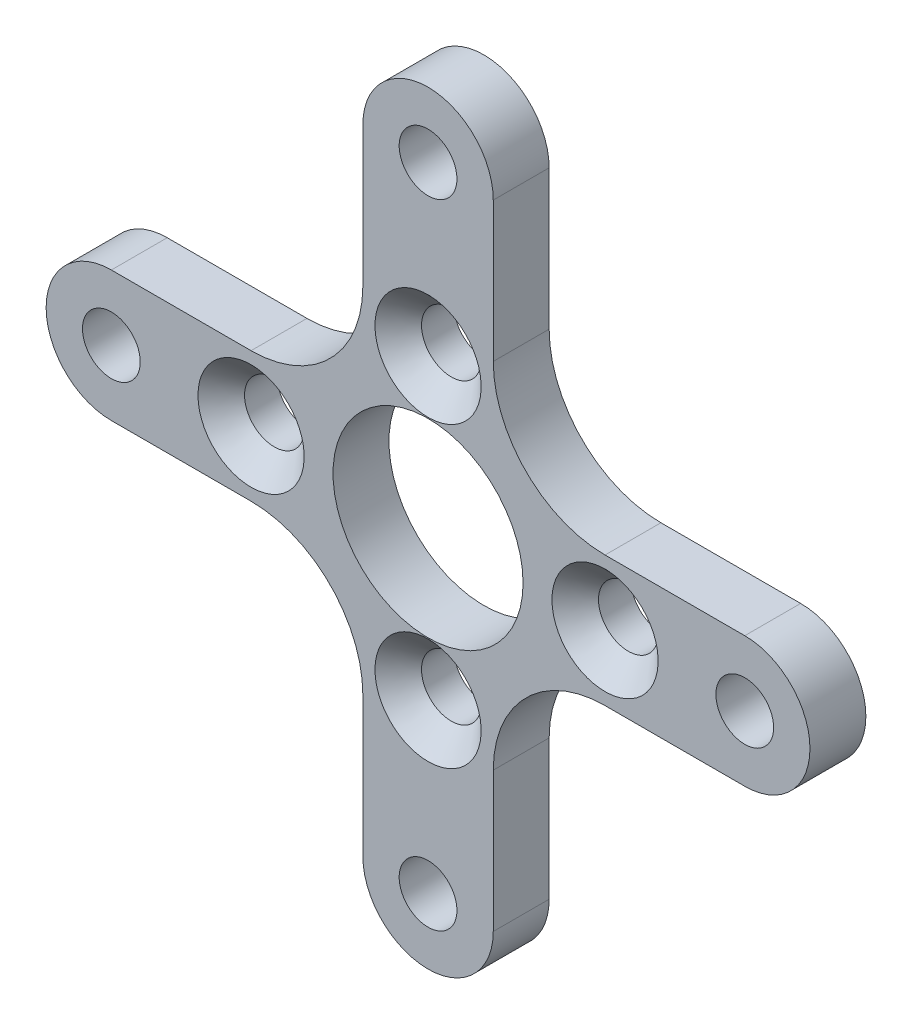
from build123d import *

# Parameters (mm, degrees)
SKETCH1_R           = 5.1
SKETCH1_R_2         = 1.6
SKETCH1_R_3         = 1.55
BOSS_EXTRUDE1_DEPTH = 3
CHAMFER1_SIZE       = 1.25


with BuildPart() as part:
    # Sketch1 → Boss-Extrude1 (new body)
    with BuildSketch(Plane(origin=(0, 0, 0), x_dir=(0, 1, 0), z_dir=(0, 0, 1))):
        with BuildLine():
            Line((3.5, 17), (3.5, 9.5))
            ThreePointArc((3.5, 9.5), (5.257359313, 5.257359313), (9.5, 3.5))
            Line((9.5, 3.5), (17, 3.5))
            ThreePointArc((17, 3.5), (20.5, 0), (17, -3.5))
            Line((17, -3.5), (9.5, -3.5))
            ThreePointArc((9.5, -3.5), (5.257359313, -5.257359313), (3.5, -9.5))
            Line((3.5, -9.5), (3.5, -17))
            ThreePointArc((3.5, -17), (0, -20.5), (-3.5, -17))
            Line((-3.5, -17), (-3.5, -9.5))
            ThreePointArc((-3.5, -9.5), (-5.257359313, -5.257359313), (-9.5, -3.5))
            Line((-9.5, -3.5), (-17, -3.5))
            ThreePointArc((-17, -3.5), (-20.5, 0), (-17, 3.5))
            Line((-17, 3.5), (-9.5, 3.5))
            ThreePointArc((-9.5, 3.5), (-5.257359313, 5.257359313), (-3.5, 9.5))
            Line((-3.5, 9.5), (-3.5, 17))
            ThreePointArc((-3.5, 17), (0, 20.5), (3.5, 17))
        make_face()
        with Locations(Location((0, 0, 0), (0, 0, 270))):
            Circle(SKETCH1_R, mode=Mode.SUBTRACT)
        with Locations(Location((0, 9.5, 0), (0, 0, 270))):
            Circle(SKETCH1_R_2, mode=Mode.SUBTRACT)
        with Locations(Location((8, 0, 0), (0, 0, 270))):
            Circle(SKETCH1_R_2, mode=Mode.SUBTRACT)
        with Locations(Location((-8, 0, 0), (0, 0, 270))):
            Circle(SKETCH1_R_2, mode=Mode.SUBTRACT)
        with Locations(Location((0, -9.5, 0), (0, 0, 270))):
            Circle(SKETCH1_R_2, mode=Mode.SUBTRACT)
        with Locations(Location((0, 17, 0), (0, 0, 270))):
            Circle(SKETCH1_R_3, mode=Mode.SUBTRACT)
        with Locations(Location((17, 0, 0), (0, 0, 270))):
            Circle(SKETCH1_R_3, mode=Mode.SUBTRACT)
        with Locations(Location((-17, 0, 0), (0, 0, 270))):
            Circle(SKETCH1_R_3, mode=Mode.SUBTRACT)
        with Locations(Location((0, -17, 0), (0, 0, 270))):
            Circle(SKETCH1_R_3, mode=Mode.SUBTRACT)
    extrude(amount=BOSS_EXTRUDE1_DEPTH)

    # Chamfer1
    chamfer1_edges = [part.edges().sort_by_distance(p)[0] for p in [
        (-11.1, 0, 3),
        (-1.6, 8, 3),
        (-1.6, -8, 3),
        (7.9, 0, 3),
    ]]
    chamfer(chamfer1_edges, length=CHAMFER1_SIZE)


solid = part.part
